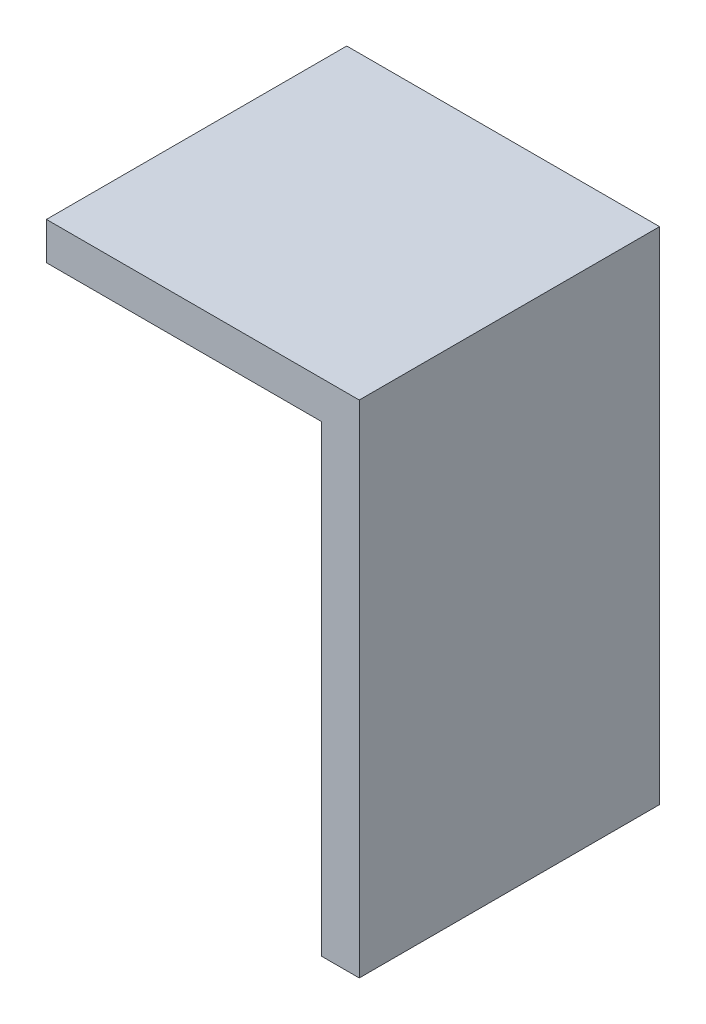
from build123d import *

# Parameters (mm, degrees)
P01_CONTACTTOPLEG_START = 37
SK_P01_CONTACTTOPLEG_W  = 25
SK_P01_CONTACTTOPLEG_H  = 24
P01_CONTACTTOPLEG_DEPTH = 3
SK_P02_CONTACTFACE_W    = 3
SK_P02_CONTACTFACE_H    = 24
P02_CONTACTFACE_DEPTH   = 37


with BuildPart() as part:
    # SK_P01_Contacttopleg → P01_Contacttopleg (new body)
    with BuildSketch(Plane(origin=(0, 0, 0), x_dir=(1, 0, 0), z_dir=(0, 1, 0)).offset(P01_CONTACTTOPLEG_START)):
        Rectangle(SK_P01_CONTACTTOPLEG_W, SK_P01_CONTACTTOPLEG_H)
    extrude(amount=P01_CONTACTTOPLEG_DEPTH)

    # SK_P02_Contactface → P02_Contactface (add)
    with BuildSketch(Plane(origin=(0, 0, 0), x_dir=(1, 0, 0), z_dir=(0, 1, 0))):
        with Locations((11, 0)):
            Rectangle(SK_P02_CONTACTFACE_W, SK_P02_CONTACTFACE_H)
    extrude(amount=P02_CONTACTFACE_DEPTH)


solid = part.part
